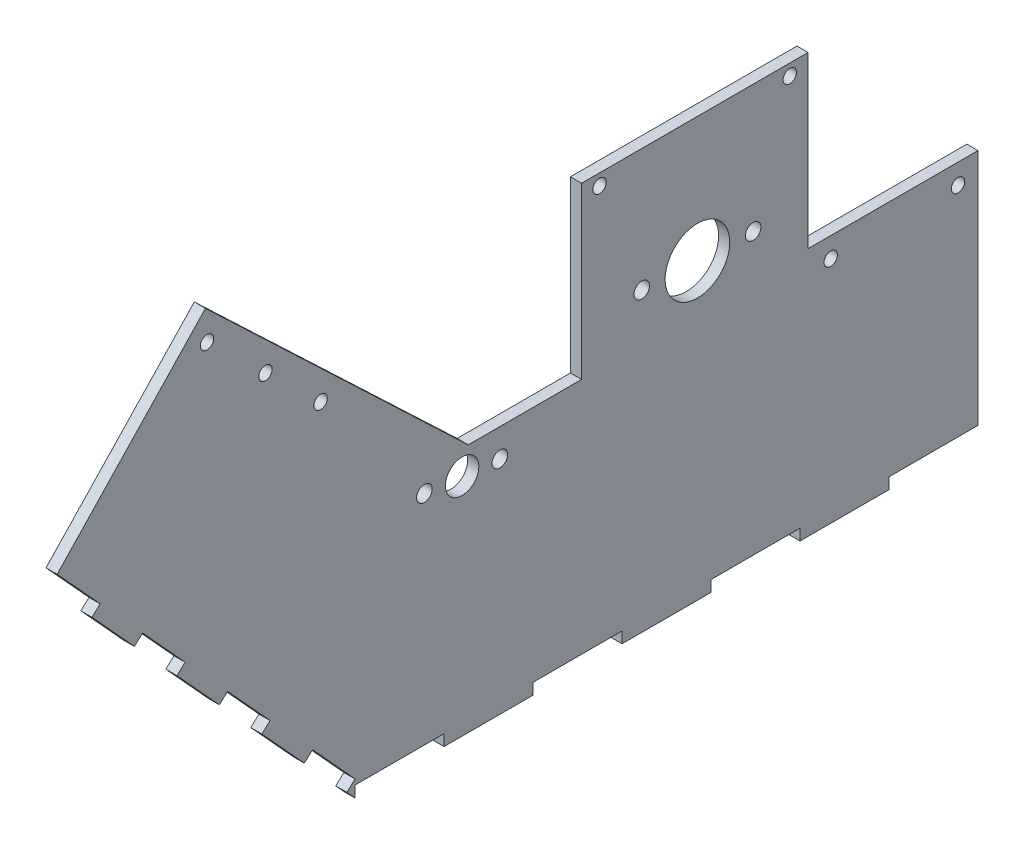
from build123d import *

# Parameters (mm, degrees)
SKETCH1_R           = 1.75
SKETCH1_R_2         = 3.75
SKETCH1_R_3         = 7.25
BOSS_EXTRUDE1_DEPTH = 2.5
SKETCH2_R           = 1.5
CUT_EXTRUDE1_DEPTH  = 45.72
SKETCH3_W           = 19.957142857
SKETCH3_H           = 2.5
CUT_EXTRUDE2_DEPTH  = 2.54
CUT_EXTRUDE3_DEPTH  = 2.54


with BuildPart() as part:
    # Sketch1 → Boss-Extrude1 (new body)
    with BuildSketch(Plane(origin=(0, 0, 0), x_dir=(0, 0, -1), z_dir=(1, 0, 0))):
        Polygon((0, 0), (25.4, 0), (25.4, 38.1), (76.2, 38.1), (76.2, 0), (114.3, 0), (114.3, -55.88), (-25.4, -55.88), (-93.919230144, 19.137831884), (-58.936151167, 55.972926363), align=None)
        with Locations((-9.840865869, -4.523881045)):
            Circle(SKETCH1_R, mode=Mode.SUBTRACT)
        with Locations((-1.386257564, -5.40114863)):
            Circle(SKETCH1_R_2, mode=Mode.SUBTRACT)
        with Locations((7.06835074, -6.278416216)):
            Circle(SKETCH1_R, mode=Mode.SUBTRACT)
        with Locations((51.390541055, 10.062014111)):
            Circle(SKETCH1_R_3, mode=Mode.SUBTRACT)
        with Locations((38.902844079, 10.616472631)):
            Circle(SKETCH1_R, mode=Mode.SUBTRACT)
        with Locations((63.87823803, 9.507555591)):
            Circle(SKETCH1_R, mode=Mode.SUBTRACT)
    extrude(amount=BOSS_EXTRUDE1_DEPTH)

    # Sketch2 → Cut-Extrude1 (cut)
    with BuildSketch(Plane.ZY):
        with Locations((-72.089288217, 35.554137698)):
            Circle(SKETCH2_R)
        with Locations((-29.434072146, 35.554137698)):
            Circle(SKETCH2_R)
        with Locations((-109.810505414, -4.492241592)):
            Circle(SKETCH2_R)
        with Locations((-81.28, -4.492241592)):
            Circle(SKETCH2_R)
        with Locations((58.584658566, 49.213818775)):
            Circle(SKETCH2_R)
        with Locations((45.481260754, 36.702251461)):
            Circle(SKETCH2_R)
        with Locations((33.116955359, 24.896394578)):
            Circle(SKETCH2_R)
    extrude(amount=-CUT_EXTRUDE1_DEPTH, mode=Mode.SUBTRACT)

    # Sketch3 → Cut-Extrude2 (cut)
    with BuildSketch(Plane.ZY):
        with Locations((-104.321428572, -54.63)):
            Rectangle(SKETCH3_W, SKETCH3_H)
        with Locations((-64.407142858, -54.63)):
            Rectangle(SKETCH3_W, SKETCH3_H)
        with Locations((-24.492857143, -54.63)):
            Rectangle(SKETCH3_W, SKETCH3_H)
        with Locations((15.421428572, -54.63)):
            Rectangle(SKETCH3_W, SKETCH3_H)
    extrude(amount=-CUT_EXTRUDE2_DEPTH, mode=Mode.SUBTRACT)

    # Sketch4 → Cut-Extrude3 (cut)
    with BuildSketch(Plane.ZY):
        Polygon((27.232932154, -53.873226195), (36.759546153, -43.443075041), (34.913634935, -41.757070362), (25.387020937, -52.187221516), align=None)
        Polygon((44.440248934, -31.326919208), (46.286160151, -33.012923887), (55.81277415, -22.582772733), (53.966862932, -20.896768054), align=None)
        Polygon((63.493476931, -10.4666169), (65.339388148, -12.152621579), (74.866002147, -1.722470425), (73.020090929, -0.036465746), align=None)
        Polygon((82.546704928, 10.393685408), (84.392616145, 8.70768073), (93.919230144, 19.137831884), (92.193270327, 20.955164571), align=None)
    extrude(amount=-CUT_EXTRUDE3_DEPTH, mode=Mode.SUBTRACT)


solid = part.part
